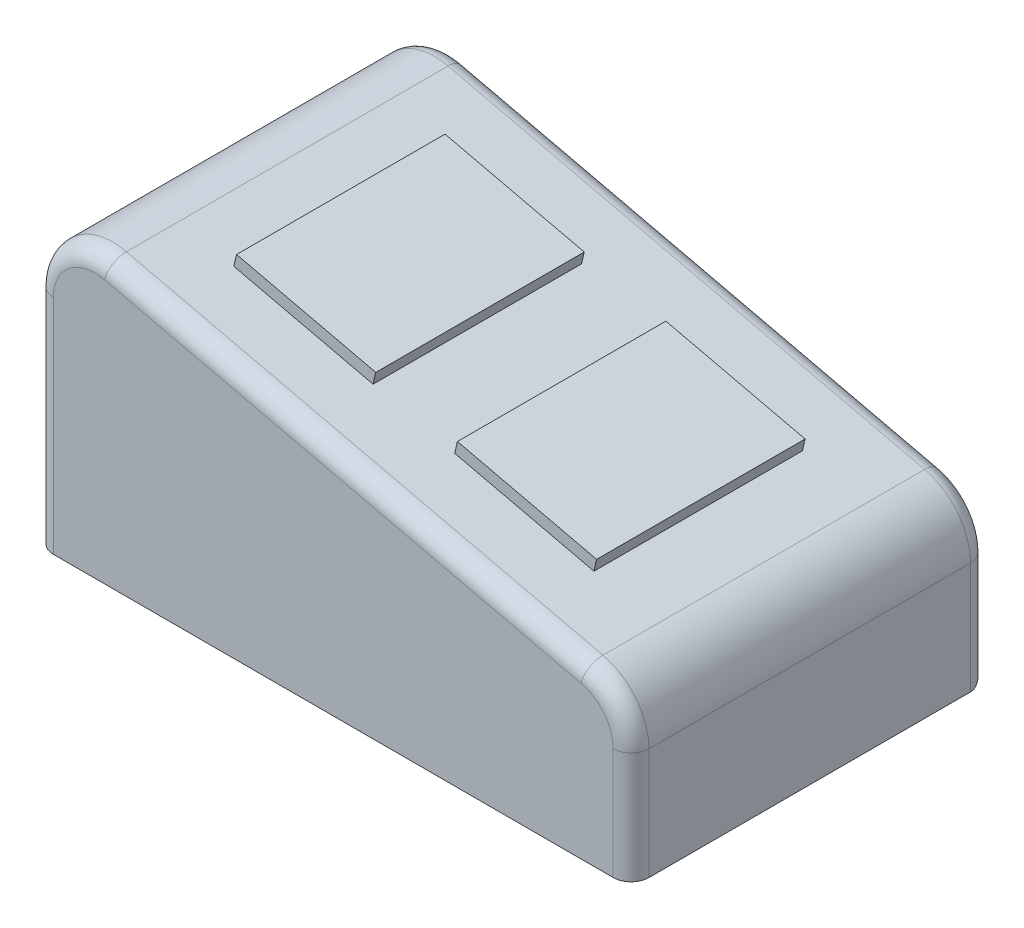
from build123d import *

# Parameters (mm, degrees)
BOSS_EXTRUDE1_DEPTH = 60
SKETCH2_W           = 24
SKETCH2_H           = 35
BOSS_EXTRUDE2_DEPTH = 2
FILLET1_R           = 3


with BuildPart() as part:
    # Sketch1 → Boss-Extrude1 (new body)
    with BuildSketch(Plane.XY):
        with BuildLine():
            Line((-54.744118035, 4.205632013), (25.255881965, -14.454907336))
            ThreePointArc((25.255881965, -14.454907336), (30.817424359, -17.97721097), (32.984293194, -24.193484463))
            Line((32.984293194, -24.193484463), (32.984293194, -42.931937173))
            Line((32.984293194, -42.931937173), (-67.015706806, -42.931937173))
            Line((-67.015706806, -42.931937173), (-67.015706806, -5.532945114))
            ThreePointArc((-67.015706806, -5.532945114), (-63.2319803, 2.300186052), (-54.744118035, 4.205632013))
        make_face()
    extrude(amount=-BOSS_EXTRUDE1_DEPTH)

    # Sketch2 → Boss-Extrude2 (add)
    with BuildSketch(Plane(origin=(-1.894488045, -8.121900487, 0), x_dir=(0.9738577126840912, -0.22715887710083071, 0), z_dir=(0.22715887710083071, 0.9738577126840912, 0))):
        with Locations((-32.992105981, 29.5)):
            Rectangle(SKETCH2_W, SKETCH2_H)
        with Locations((5.084176419, 29.5)):
            Rectangle(SKETCH2_W, SKETCH2_H)
    extrude(amount=BOSS_EXTRUDE2_DEPTH)

    # Fillet1
    fillet1_edges = [part.edges().sort_by_distance(p)[0] for p in [
        (-14.744118035, -5.124637662, -60),
        (-63.2319803, 2.300186052, -60),
        (-67.015706806, -24.232441143, -60),
        (-17.015706806, -42.931937173, -60),
        (32.984293194, -33.562710818, -60),
        (-67.015706806, -24.232441143, 0),
        (-63.2319803, 2.300186052, 0),
        (-14.744118035, -5.124637662, 0),
        (30.817424359, -17.97721097, 0),
        (32.984293194, -33.562710818, 0),
        (30.817424359, -17.97721097, -60),
    ]]
    fillet(fillet1_edges, radius=FILLET1_R)


solid = part.part
